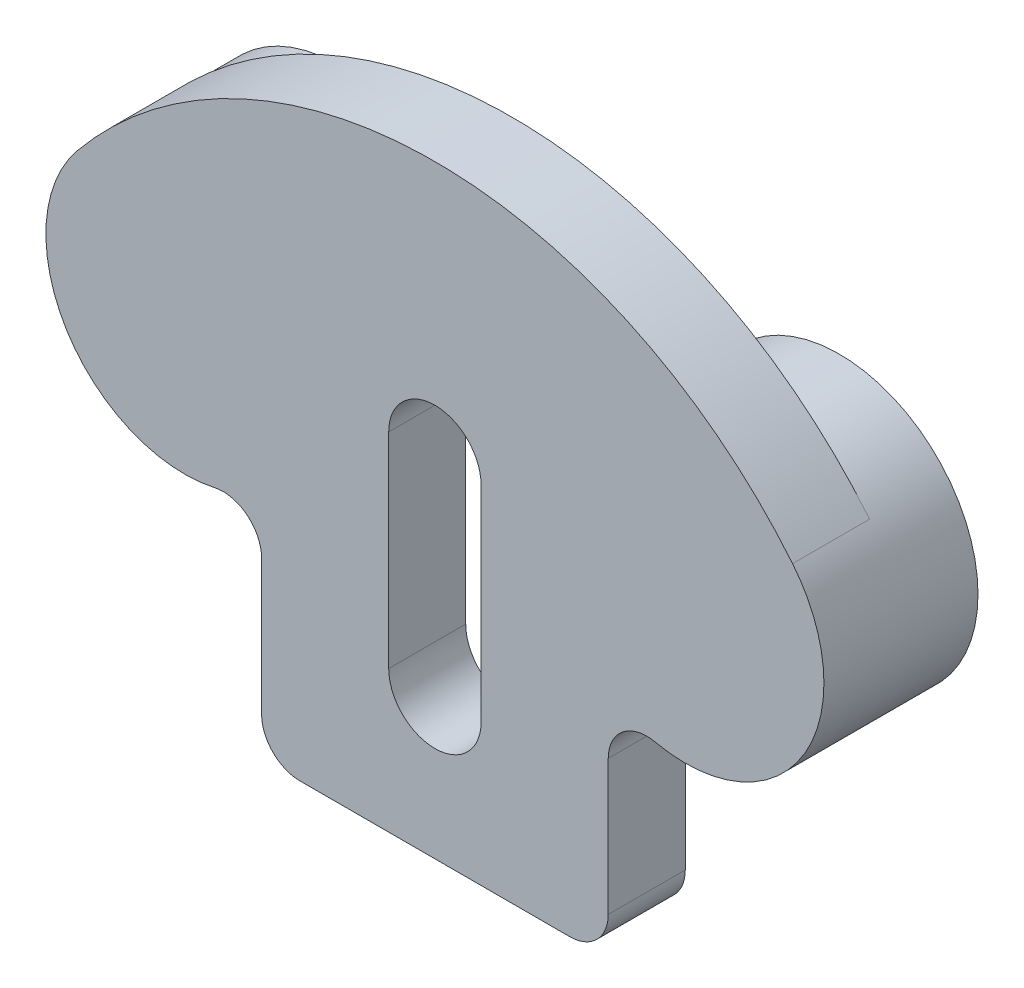
from build123d import *

# Parameters (mm, degrees)
BOSS_EXTRUDE1_DEPTH   = 10
SKETCH1_R             = 13
BOSS_EXTRUDE1_2_DEPTH = 10
BOSS_EXTRUDE1_3_DEPTH = 10
SKETCH1_3_R           = 18
SKETCH1_3_R_2         = 13
BOSS_EXTRUDE2_DEPTH   = 20


with BuildPart() as part:
    # Sketch1 → Boss-Extrude1 (new body)
    with BuildSketch(Plane.XY):
        with BuildLine():
            ThreePointArc((-22.5, -13.396428811), (-21.035533906, -16.931962717), (-17.5, -18.396428811))
            Line((-17.5, -18.396428811), (17.5, -18.396428811))
            ThreePointArc((17.5, -18.396428811), (21.035533906, -16.931962717), (22.5, -13.396428811))
            Line((22.5, -13.396428811), (22.5, 4.153626868))
            ThreePointArc((22.5, 4.153626868), (24.372283789, 8.054574356), (28.586956522, 9.034049547))
            ThreePointArc((28.586956522, 9.034049547), (17.17328588, 36.042418273), (46.428571429, 38.005101698))
            ThreePointArc((46.428571429, 38.005101698), (0, 60), (-46.428571429, 38.005101698))
            ThreePointArc((-46.428571429, 38.005101698), (-17.17328588, 36.042418273), (-28.586956522, 9.034049547))
            ThreePointArc((-28.586956522, 9.034049547), (-24.372283789, 8.054574356), (-22.5, 4.153626868))
            Line((-22.5, 4.153626868), (-22.5, -13.396428811))
        make_face()
        with BuildLine():
            ThreePointArc((6, 0), (0, -6), (-6, 0))
            Line((-6, 0), (-6, 26.603571189))
            ThreePointArc((-6, 26.603571189), (0, 32.603571189), (6, 26.603571189))
            Line((6, 26.603571189), (6, 0))
        make_face(mode=Mode.SUBTRACT)
    extrude(amount=-BOSS_EXTRUDE1_DEPTH)



with BuildPart() as body_2:
    # Sketch1 → Boss-Extrude1 2 (new body)
    with BuildSketch(Plane.XY):
        with Locations((-32.5, 26.603571189)):
            Circle(SKETCH1_R)
    extrude(amount=-BOSS_EXTRUDE1_2_DEPTH)


with BuildPart() as body_3:
    # Sketch1 → Boss-Extrude1 3 (new body)
    with BuildSketch(Plane.XY):
        with Locations((32.5, 26.603571189)):
            Circle(SKETCH1_R)
    extrude(amount=-BOSS_EXTRUDE1_3_DEPTH)


with BuildPart() as part_1:
    add(part.part)

    add(body_2.part)  # Boss-Extrude2 merges body 2

    add(body_3.part)  # Boss-Extrude2 merges body 3
    # Sketch1<3> → Boss-Extrude2 (add)
    # profile 1 of 2: a face of its own
    with BuildSketch(Plane.XY):
        with Locations((-32.5, 26.603571189)):
            Circle(SKETCH1_3_R)
        with Locations((-32.5, 26.603571189)):
            Circle(SKETCH1_3_R_2, mode=Mode.SUBTRACT)
    # profile 2 of 2: a face of its own
    with BuildSketch(Plane.XY):
        with Locations((32.5, 26.603571189)):
            Circle(SKETCH1_3_R)
        with Locations((32.5, 26.603571189)):
            Circle(SKETCH1_3_R_2, mode=Mode.SUBTRACT)
    extrude(amount=-BOSS_EXTRUDE2_DEPTH)


solid = part_1.part
